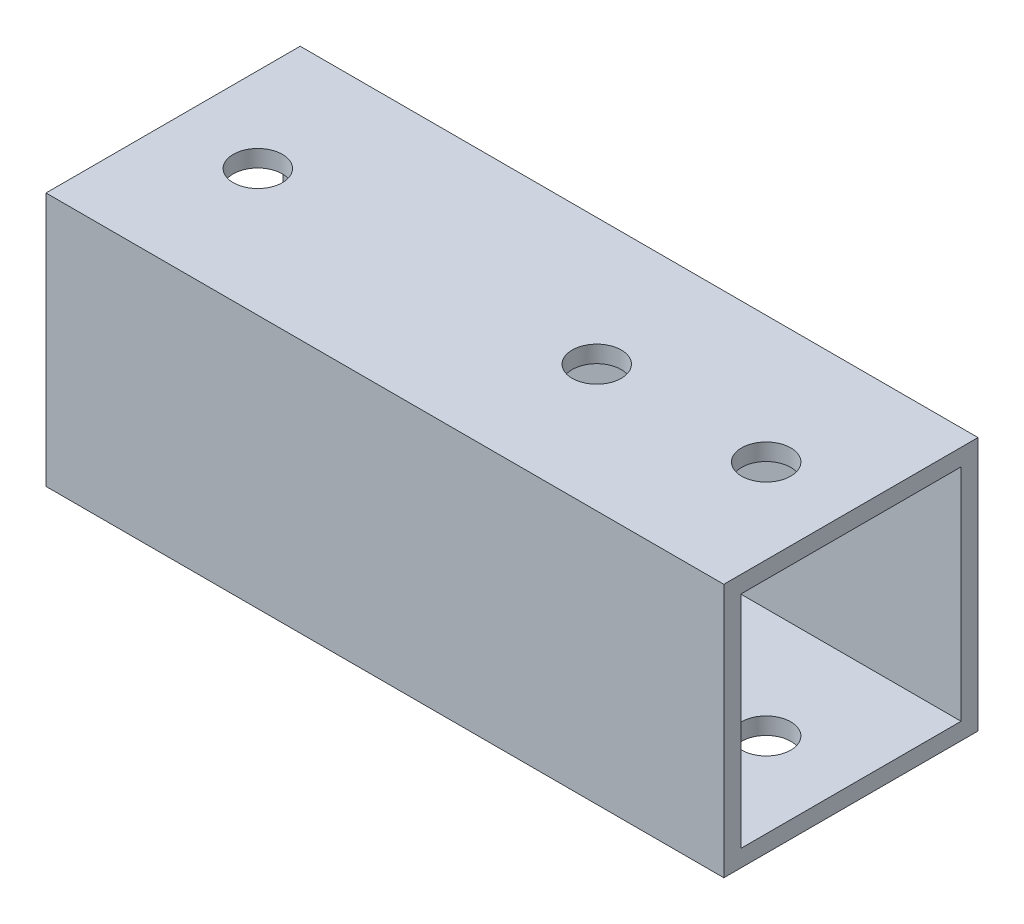
from build123d import *

# Parameters (mm, degrees)
SKETCH_1_W          = 15
SKETCH_1_H          = 15
SKETCH_1_W_2        = 13
SKETCH_1_H_2        = 13
EXTRUDE_1_DEPTH     = 40
SKETCH_2_R          = 1.45
CUT_EXTRUDE_1_DEPTH = 44.373378932


with BuildPart() as part:
    # 草图1 → 凸台-拉伸1 (new body)
    with BuildSketch(Plane(origin=(0, 0, 0), x_dir=(0, 0, -1), z_dir=(1, 0, 0))):
        Rectangle(SKETCH_1_W, SKETCH_1_H)
        Rectangle(SKETCH_1_W_2, SKETCH_1_H_2, mode=Mode.SUBTRACT)
    extrude(amount=EXTRUDE_1_DEPTH)

    # 草图2 → 切除-拉伸1 (cut, through all)
    with BuildSketch(Plane(origin=(0, 7.5, 0), x_dir=(1, 0, 0), z_dir=(0, 1, 0))):
        with Locations(Location((5, 0, 0), (0, 0, 270))):
            Circle(SKETCH_2_R)
        with Locations(Location((25, 0, 0), (0, 0, 270))):
            Circle(SKETCH_2_R)
        with Locations(Location((35, 0, 0), (0, 0, 270))):
            Circle(SKETCH_2_R)
    extrude(amount=-CUT_EXTRUDE_1_DEPTH, mode=Mode.SUBTRACT)


solid = part.part
